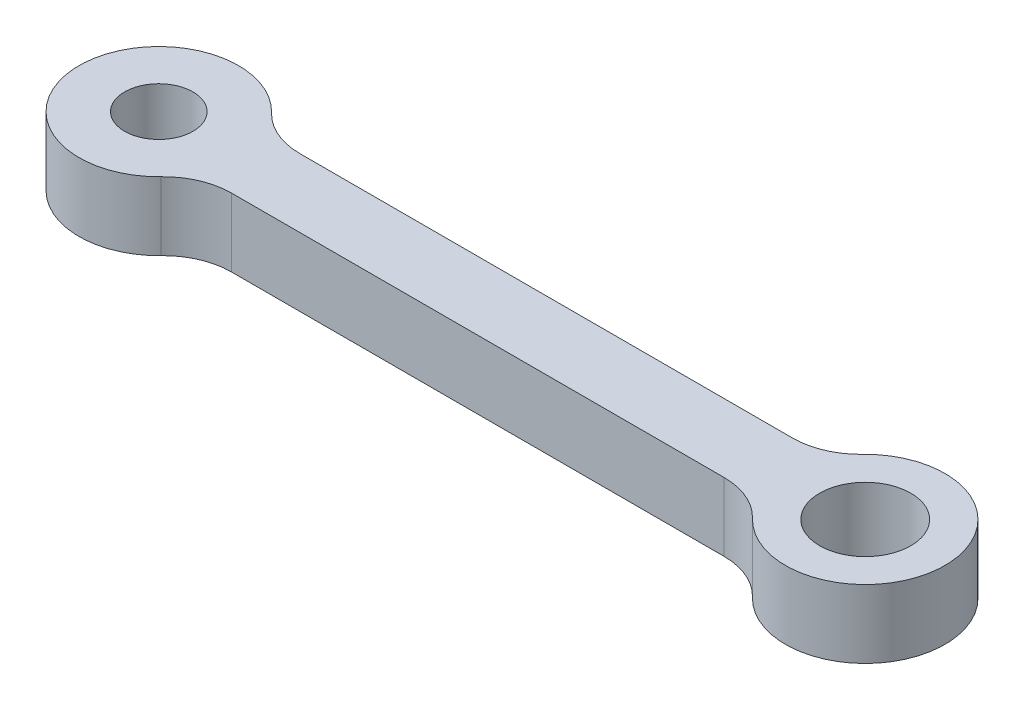
from build123d import *

# Parameters (mm, degrees)
SKETCH1_R           = 1.5
SKETCH1_R_2         = 2
BOSS_EXTRUDE1_DEPTH = 3
FILLET1_R           = 3


with BuildPart() as part:
    # Sketch1 → Boss-Extrude1 (new body)
    with BuildSketch(Plane(origin=(0, 0, 0), x_dir=(1, 0, 0), z_dir=(0, 1, 0))):
        with BuildLine():
            ThreePointArc((3.16227766, 1.5), (-3.5, 0), (3.16227766, -1.5))
            Line((3.16227766, -1.5), (27.83772234, -1.5))
            ThreePointArc((27.83772234, -1.5), (34.5, 0), (27.83772234, 1.5))
            Line((27.83772234, 1.5), (3.16227766, 1.5))
        make_face()
        with Locations(Location((0, 0, 0), (0, 0, 270))):
            Circle(SKETCH1_R, mode=Mode.SUBTRACT)
        with Locations(Location((31, 0, 0), (0, 0, 270))):
            Circle(SKETCH1_R_2, mode=Mode.SUBTRACT)
    extrude(amount=BOSS_EXTRUDE1_DEPTH)

    # Fillet1
    fillet1_edges = [part.edges().sort_by_distance(p)[0] for p in [
        (27.83772234, 1.5, 1.5),
        (3.16227766, 1.5, 1.5),
        (3.16227766, 1.5, -1.5),
        (27.83772234, 1.5, -1.5),
    ]]
    fillet(fillet1_edges, radius=FILLET1_R)


solid = part.part
